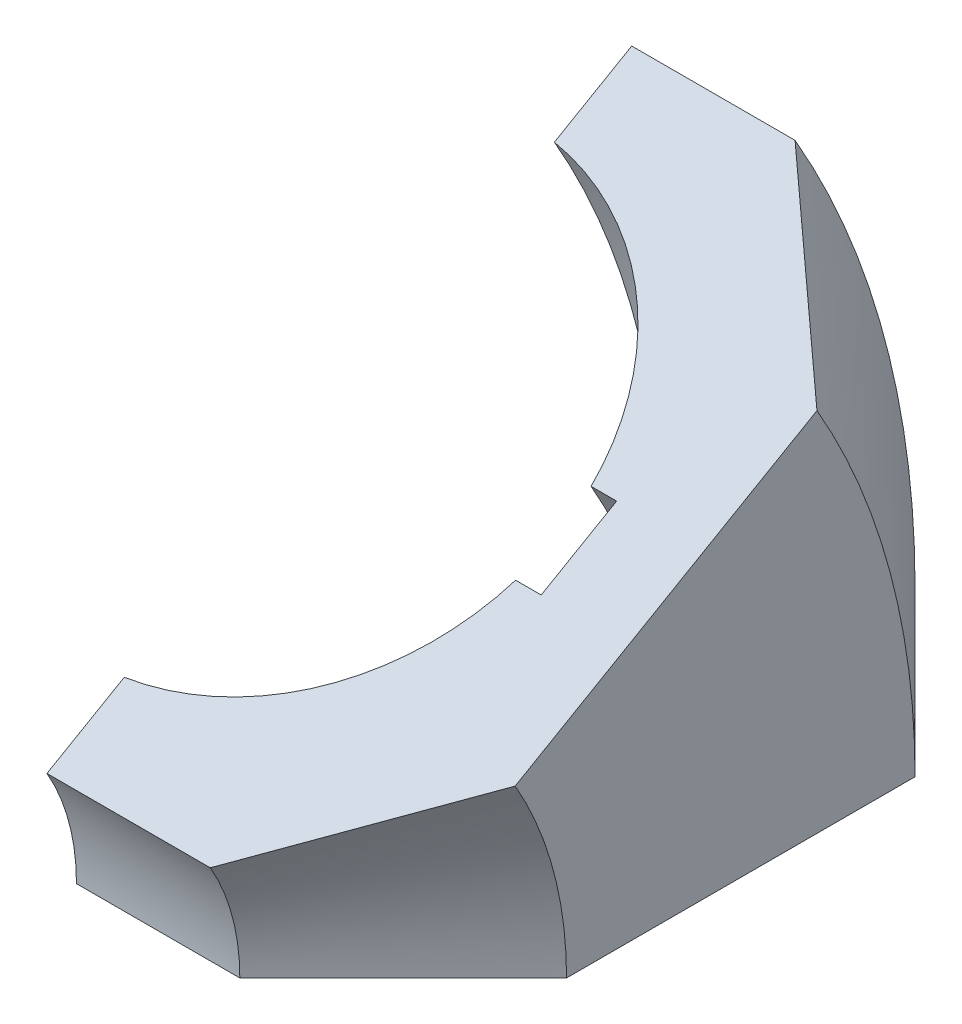
from build123d import *

# Parameters (mm, degrees)
CHAMFER1_SIZE = 15


with BuildPart() as part:
    # Sweep3: sweep along a path in Sketch1
    with BuildLine(Plane(origin=(0, 0, 0), x_dir=(0, 0, -1), z_dir=(1, 0, 0))) as sweep3_path:
        ThreePointArc((-6.865334795, 25.621778265), (-1.746081847, 13.262808369), (0, 0))
    # Sketch2 → Sweep3 (sweep)
    with BuildSketch(Plane(origin=(0, 0, 0), x_dir=(1, 0, 0), z_dir=(0, 1, 0))):
        with BuildLine():
            Line((3, 22.803508502), (3, 31))
            Line((3, 31), (33, 31))
            Line((33, 31), (33, -31))
            Line((33, -31), (3, -31))
            Line((3, -31), (3, -22.803508502))
            ThreePointArc((3, -22.803508502), (15.901799834, -16.617242913), (22.649503306, -4))
            Line((22.649503306, -4), (25, -4))
            Line((25, -4), (25, 4))
            Line((25, 4), (22.649503306, 4))
            ThreePointArc((22.649503306, 4), (15.901799834, 16.617242913), (3, 22.803508502))
        make_face()
    sweep(path=sweep3_path.line)

    # Chamfer1
    chamfer1_edges = [part.edges().sort_by_distance(p)[0] for p in [
        (33, 5.239417971, 31.689782462),
        (33, 21.286198767, -28.197618768),
    ]]
    chamfer(chamfer1_edges, length=CHAMFER1_SIZE)


solid = part.part
